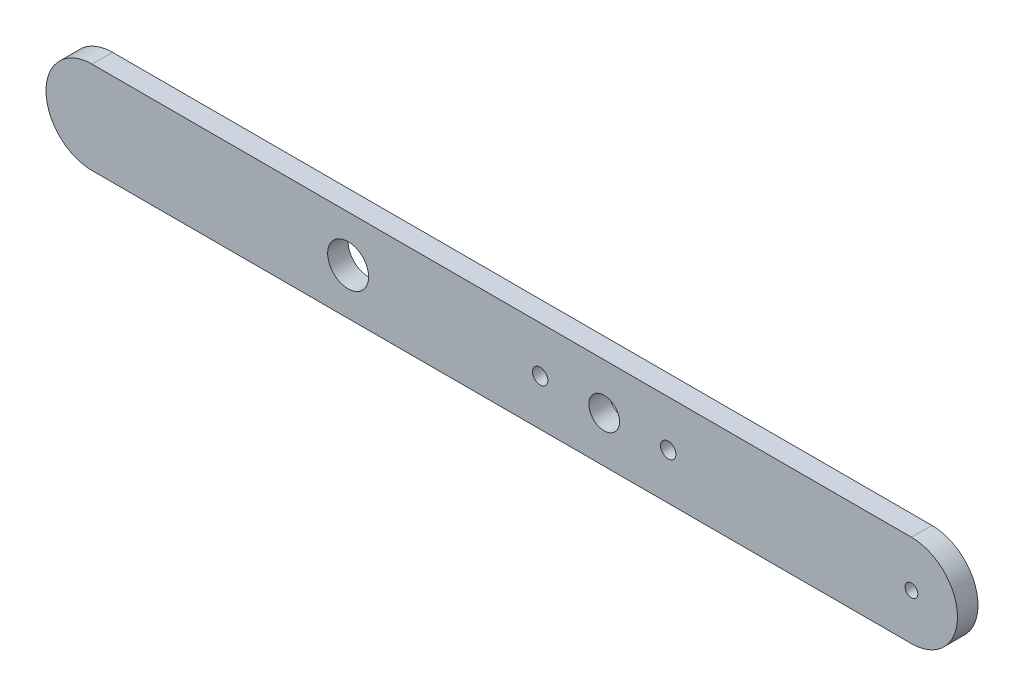
from build123d import *

# Parameters (mm, degrees)
SKETCH_1_R          = 1.25
SKETCH_1_R_2        = 3
SKETCH_1_R_3        = 4
EXTRUDE_1_DEPTH     = 4
SKETCH_2_R          = 1.5
CUT_EXTRUDE_1_DEPTH = 170.286738996


with BuildPart() as part:
    # ｽｹｯﾁ1 → ﾎﾞｽ - 押し出し1 (new body)
    with BuildSketch(Plane.XY):
        with BuildLine():
            Line((0, 9), (160, 9))
            ThreePointArc((160, 9), (169, 0), (160, -9))
            Line((160, -9), (0, -9))
            ThreePointArc((0, -9), (-9, 0), (0, 9))
        make_face()
        with Locations((160, 0)):
            Circle(SKETCH_1_R, mode=Mode.SUBTRACT)
        with Locations((100, 0)):
            Circle(SKETCH_1_R_2, mode=Mode.SUBTRACT)
        with Locations((50, 0)):
            Circle(SKETCH_1_R_3, mode=Mode.SUBTRACT)
    extrude(amount=EXTRUDE_1_DEPTH)

    # ｽｹｯﾁ2 → ｶｯﾄ - 押し出し1 (cut, through all)
    with BuildSketch(Plane.XY.offset(4)):
        with Locations((112.5, 0)):
            Circle(SKETCH_2_R)
        with Locations(Location((87.5, 0, 0), (0, 0, 180))):
            Circle(SKETCH_2_R)
    extrude(amount=-CUT_EXTRUDE_1_DEPTH, mode=Mode.SUBTRACT)


solid = part.part
